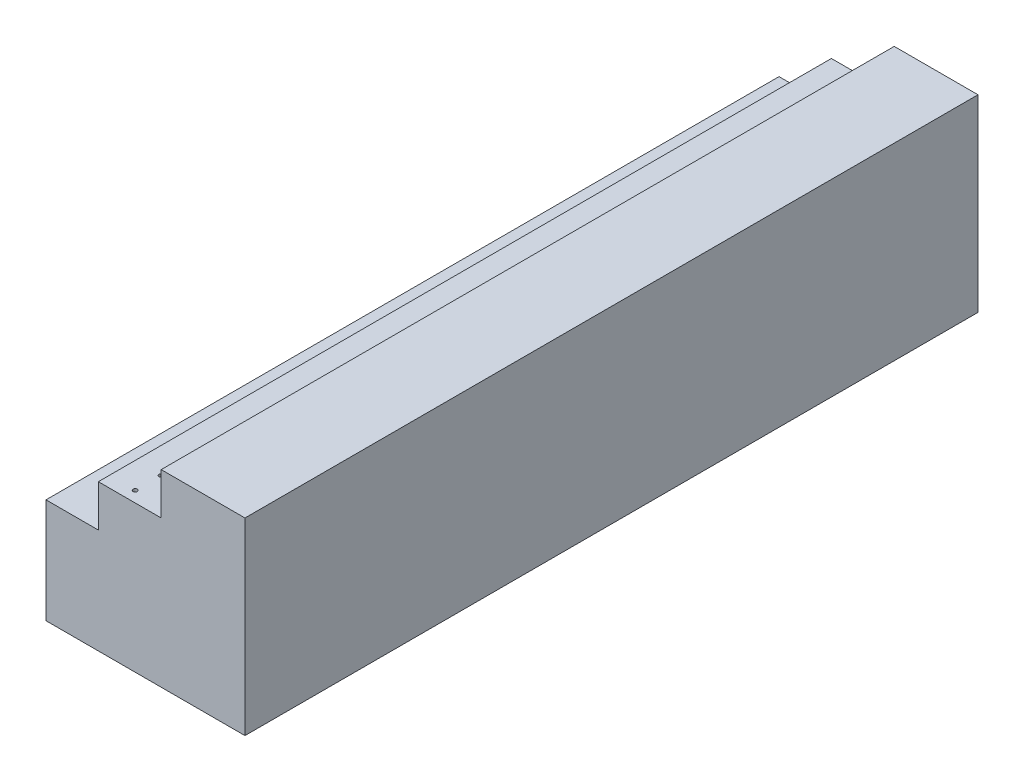
from build123d import *

# Parameters (mm, degrees)
SKETCH_1_W           = 250
SKETCH_1_H           = 3500
EXTRUDE_1_DEPTH      = 300
SKETCH_1_3_W         = 250
SKETCH_1_3_H         = 3500
EXTRUDE_2_DEPTH      = 500
SKETCH_1_4_W         = 300
SKETCH_1_4_H         = 3500
EXTRUDE_3_DEPTH      = 700
SKETCH_1_5_W         = 340
SKETCH_1_5_H         = 3500
EXTRUDE_4_DEPTH      = 900
SKETCH_1_6_W         = 60
SKETCH_1_6_H         = 3500
EXTRUDE_5_DEPTH      = 900
SKETCH_2_R           = 10
SKETCH_2_R_2         = 12.335954766
CUT_EXTRUDE_1_DEPTH  = 230
SKETCH_10_R          = 10
SKETCH_10_R_2        = 12.335954766
CUT_EXTRUDE_8_DEPTH  = 230
SKETCH_16_R          = 10
SKETCH_16_R_2        = 12.335954766
CUT_EXTRUDE_14_DEPTH = 230


with BuildPart() as part:
    # Эскиз1 → Бобышка-Вытянуть1 (new body)
    with BuildSketch(Plane(origin=(0, 0, 0), x_dir=(1, 0, 0), z_dir=(0, 1, 0))):
        with Locations((375, 1750)):
            Rectangle(SKETCH_1_W, SKETCH_1_H)
    extrude(amount=EXTRUDE_1_DEPTH)

    # Эскиз1<3> → Бобышка-Вытянуть2 (add)
    with BuildSketch(Plane(origin=(0, 0, 0), x_dir=(1, 0, 0), z_dir=(0, 1, 0))):
        with Locations((375, 1750)):
            Rectangle(SKETCH_1_3_W, SKETCH_1_3_H)
    extrude(amount=EXTRUDE_2_DEPTH)

    # Эскиз1<4> → Бобышка-Вытянуть3 (add)
    with BuildSketch(Plane(origin=(0, 0, 0), x_dir=(1, 0, 0), z_dir=(0, 1, 0))):
        with Locations((650, 1750)):
            Rectangle(SKETCH_1_4_W, SKETCH_1_4_H)
    extrude(amount=EXTRUDE_3_DEPTH)

    # Эскиз1<5> → Бобышка-Вытянуть4 (add)
    with BuildSketch(Plane(origin=(0, 0, 0), x_dir=(1, 0, 0), z_dir=(0, 1, 0))):
        with Locations((970, 1750)):
            Rectangle(SKETCH_1_5_W, SKETCH_1_5_H)
    extrude(amount=EXTRUDE_4_DEPTH)

    # Эскиз1<6> → Бобышка-Вытянуть5 (add)
    with BuildSketch(Plane(origin=(0, 0, 0), x_dir=(1, 0, 0), z_dir=(0, 1, 0))):
        with Locations((1170, 1750)):
            Rectangle(SKETCH_1_6_W, SKETCH_1_6_H)
    extrude(amount=EXTRUDE_5_DEPTH)

    # Эскиз2 → Вырез-Вытянуть1 (cut)
    with BuildSketch(Plane(origin=(0, 700, 0), x_dir=(1, 0, 0), z_dir=(0, 1, 0))):
        with Locations((625, 3357.152132265)):
            Circle(SKETCH_2_R)
        with Locations((625, 3243.136997035)):
            Circle(SKETCH_2_R)
        with Locations((625, 3145.792962986)):
            Circle(SKETCH_2_R)
        with Locations((625, 3016.463867162)):
            Circle(SKETCH_2_R)
        with Locations((625, 2886.892438707)):
            Circle(SKETCH_2_R)
        with Locations((625, 2776.185031262)):
            Circle(SKETCH_2_R)
        with Locations((625, 2652.112531743)):
            Circle(SKETCH_2_R)
        with Locations((625, 2528.615192208)):
            Circle(SKETCH_2_R)
        with Locations((625, 2426.866506998)):
            Circle(SKETCH_2_R)
        with Locations((625, 2323.054011053)):
            Circle(SKETCH_2_R)
        with Locations((625, 2236.363113826)):
            Circle(SKETCH_2_R_2)
    extrude(amount=-CUT_EXTRUDE_1_DEPTH, mode=Mode.SUBTRACT)

    # Эскиз10 → Вырез-Вытянуть8 (cut)
    with BuildSketch(Plane(origin=(0, 700, 0), x_dir=(1, 0, 0), z_dir=(0, 1, 0))):
        with Locations((632.852016255, 2116.617341228)):
            Circle(SKETCH_10_R)
        with Locations((632.852016255, 2002.602205997)):
            Circle(SKETCH_10_R)
        with Locations((632.852016255, 1905.258171949)):
            Circle(SKETCH_10_R)
        with Locations((632.852016255, 1775.929076125)):
            Circle(SKETCH_10_R)
        with Locations((632.852016255, 1646.35764767)):
            Circle(SKETCH_10_R)
        with Locations((632.852016255, 1535.650240224)):
            Circle(SKETCH_10_R)
        with Locations((632.852016255, 1411.577740705)):
            Circle(SKETCH_10_R)
        with Locations((632.852016255, 1288.08040117)):
            Circle(SKETCH_10_R)
        with Locations((632.852016255, 1186.33171596)):
            Circle(SKETCH_10_R)
        with Locations((632.852016255, 1082.519220016)):
            Circle(SKETCH_10_R)
        with Locations((632.852016255, 995.828322788)):
            Circle(SKETCH_10_R_2)
    extrude(amount=-CUT_EXTRUDE_8_DEPTH, mode=Mode.SUBTRACT)

    # Эскиз16 → Вырез-Вытянуть14 (cut)
    with BuildSketch(Plane(origin=(0, 700, 0), x_dir=(1, 0, 0), z_dir=(0, 1, 0))):
        with Locations((623.672758158, 880.722913646)):
            Circle(SKETCH_16_R)
        with Locations((623.672758158, 766.707778415)):
            Circle(SKETCH_16_R)
        with Locations((623.672758158, 669.363744367)):
            Circle(SKETCH_16_R)
        with Locations((623.672758158, 540.034648543)):
            Circle(SKETCH_16_R)
        with Locations((623.672758158, 410.463220088)):
            Circle(SKETCH_16_R)
        with Locations((623.672758158, 299.755812642)):
            Circle(SKETCH_16_R)
        with Locations((623.672758158, 175.683313124)):
            Circle(SKETCH_16_R)
        with Locations((623.672758158, 52.185973589)):
            Circle(SKETCH_16_R)
        with Locations((623.672758158, -49.562711622)):
            Circle(SKETCH_16_R)
        with Locations((623.672758158, -153.375207566)):
            Circle(SKETCH_16_R)
        with Locations((623.672758158, -240.066104793)):
            Circle(SKETCH_16_R_2)
    extrude(amount=-CUT_EXTRUDE_14_DEPTH, mode=Mode.SUBTRACT)


solid = part.part
